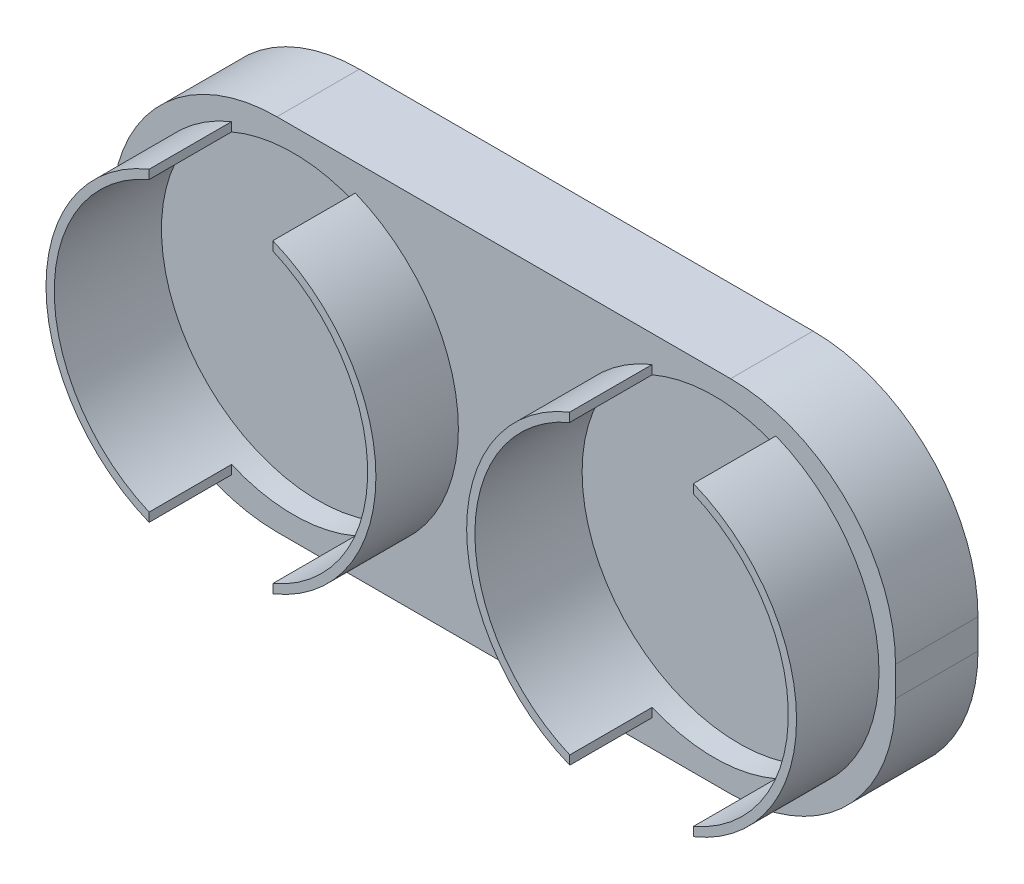
from build123d import *

# Parameters (mm, degrees)
SKETCH1_W           = 43.6
SKETCH1_H           = 95
BOSS_EXTRUDE1_DEPTH = 10
SKETCH2_R           = 3.9
BOSS_EXTRUDE2_DEPTH = 4
SKETCH5_R           = 20
SKETCH5_R_2         = 19
BOSS_EXTRUDE4_DEPTH = 10
SKETCH6_W           = 15
SKETCH6_H           = 43.6
CUT_EXTRUDE1_DEPTH  = 10
FILLET1_R           = 20
CUT_EXTRUDE2_START  = -3
SKETCH7_R           = 19
CUT_EXTRUDE2_DEPTH  = 3


with BuildPart() as part:
    # Sketch1 → Boss-Extrude1 (new body)
    with BuildSketch(Plane(origin=(0, 0, 0), x_dir=(0, 1, 0), z_dir=(0, 0, 1))):
        Rectangle(SKETCH1_W, SKETCH1_H)
    extrude(amount=BOSS_EXTRUDE1_DEPTH)

    # Sketch2 → Boss-Extrude2 (add)
    with BuildSketch(Plane(origin=(0, 0, 0), x_dir=(1, 0, 0), z_dir=(0, 0, -1))):
        with Locations(Location((0, 12.45, 0), (0, 0, 180))):
            Circle(SKETCH2_R)
        with Locations(Location((0, -12.45, 0), (0, 0, 180))):
            Circle(SKETCH2_R)
    extrude(amount=BOSS_EXTRUDE2_DEPTH)

    # Sketch5 → Boss-Extrude4 (add)
    # profile 1 of 2: a face of its own
    with BuildSketch(Plane.XY.offset(10)):
        with Locations((-25.5, 0)):
            Circle(SKETCH5_R)
        with Locations((-25.5, 0)):
            Circle(SKETCH5_R_2, mode=Mode.SUBTRACT)
    # profile 2 of 2: a face of its own
    with BuildSketch(Plane.XY.offset(10)):
        with Locations((25.5, 0)):
            Circle(SKETCH5_R)
        with Locations((25.5, 0)):
            Circle(SKETCH5_R_2, mode=Mode.SUBTRACT)
    extrude(amount=BOSS_EXTRUDE4_DEPTH)

    # Sketch6 → Cut-Extrude1 (cut)
    with BuildSketch(Plane.XY.offset(20)):
        with Locations((-25.5, 0)):
            Rectangle(SKETCH6_W, SKETCH6_H)
        with Locations((25.5, 0)):
            Rectangle(SKETCH6_W, SKETCH6_H)
    extrude(amount=-CUT_EXTRUDE1_DEPTH, mode=Mode.SUBTRACT)

    # Fillet1
    fillet1_edges = [part.edges().sort_by_distance(p)[0] for p in [
        (47.5, 21.8, 5),
        (47.5, -21.8, 5),
        (-47.5, -21.8, 5),
        (-47.5, 21.8, 5),
    ]]
    fillet(fillet1_edges, radius=FILLET1_R)

    # Sketch7 → Cut-Extrude2 (cut)
    with BuildSketch(Plane.XY.offset(10).offset(CUT_EXTRUDE2_START)):
        with Locations(Location((-25.5, 0, 0), (0, 0, 246.750437409))):
            Circle(SKETCH7_R)
        with Locations(Location((25.5, 0, 0), (0, 0, 180))):
            Circle(SKETCH7_R)
    extrude(amount=CUT_EXTRUDE2_DEPTH, mode=Mode.SUBTRACT)


solid = part.part
